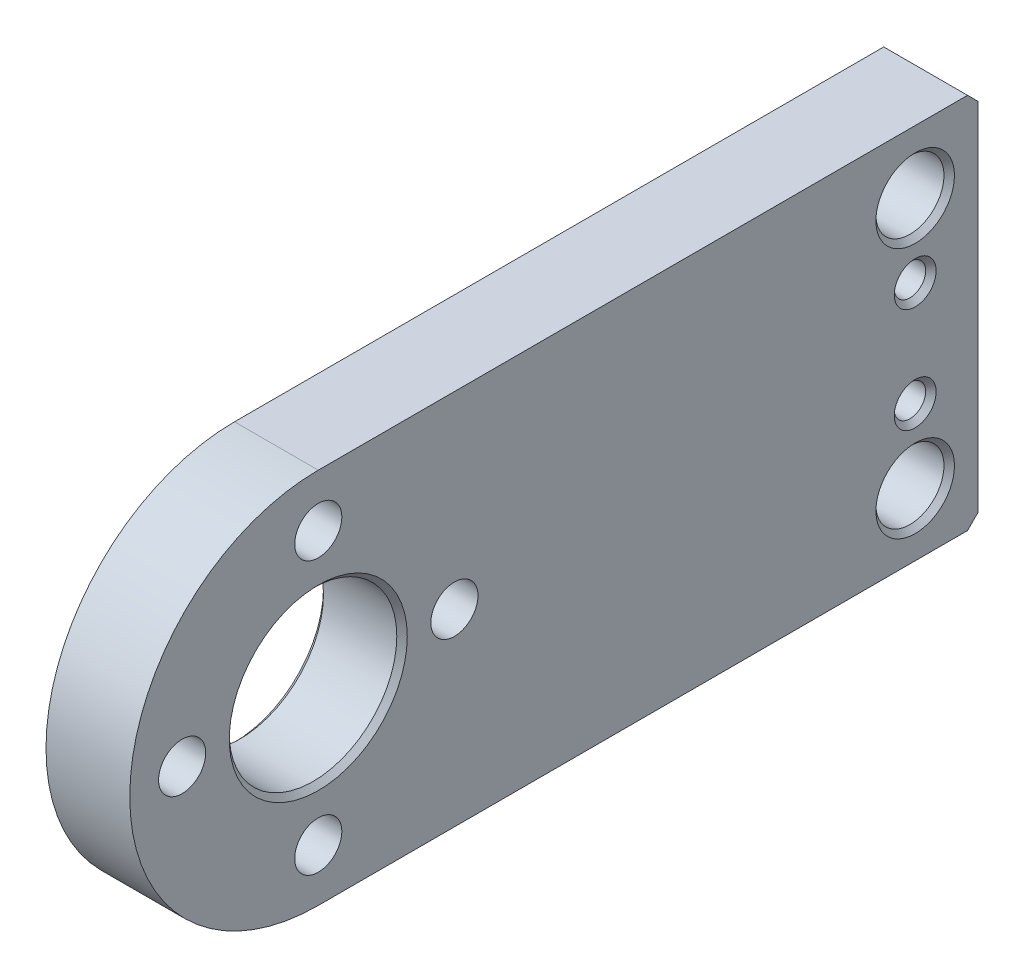
from build123d import *

# Parameters (mm, degrees)
SKETCH1_R           = 8
SKETCH1_R_2         = 2.25
SKETCH1_R_3         = 3.25
SKETCH1_R_4         = 1.5
BOSS_EXTRUDE1_DEPTH = 8
CHAMFER1_SIZE       = 1
CHAMFER2_SIZE       = 0.5


with BuildPart() as part:
    # Sketch1 → Boss-Extrude1 (new body)
    with BuildSketch(Plane(origin=(0, 0, 0), x_dir=(0, 0, -1), z_dir=(1, 0, 0))):
        with BuildLine():
            Line((-31.438596491, 20.385964912), (31.561403509, 20.385964912))
            Line((31.561403509, 20.385964912), (31.561403509, -15.614035088))
            Line((31.561403509, -15.614035088), (-31.438596491, -15.614035088))
            ThreePointArc((-31.438596491, -15.614035088), (-49.438596491, 2.385964912), (-31.438596491, 20.385964912))
        make_face()
        with Locations((-31.438596491, 2.385964912)):
            Circle(SKETCH1_R, mode=Mode.SUBTRACT)
        with Locations((-31.438596491, 15.385964912)):
            Circle(SKETCH1_R_2, mode=Mode.SUBTRACT)
        with Locations((-18.438596491, 2.385964912)):
            Circle(SKETCH1_R_2, mode=Mode.SUBTRACT)
        with Locations((-31.438596491, -10.614035088)):
            Circle(SKETCH1_R_2, mode=Mode.SUBTRACT)
        with Locations((-44.438596491, 2.385964912)):
            Circle(SKETCH1_R_2, mode=Mode.SUBTRACT)
        with Locations((25.561403509, 14.385964912)):
            Circle(SKETCH1_R_3, mode=Mode.SUBTRACT)
        with Locations((25.561403509, 7.385964912)):
            Circle(SKETCH1_R_4, mode=Mode.SUBTRACT)
        with Locations(Location((25.561403509, -2.614035088, 0), (0, 0, 180))):
            Circle(SKETCH1_R_4, mode=Mode.SUBTRACT)
        with Locations(Location((25.561403509, -9.614035088, 0), (0, 0, 180))):
            Circle(SKETCH1_R_3, mode=Mode.SUBTRACT)
    extrude(amount=BOSS_EXTRUDE1_DEPTH)

    # Chamfer1
    chamfer1_edges = [part.edges().sort_by_distance(p)[0] for p in [
        (4, 20.385964912, -31.561403509),
        (4, -15.614035088, -31.561403509),
    ]]
    chamfer(chamfer1_edges, length=CHAMFER1_SIZE)

    # Chamfer2
    chamfer2_edges = [part.edges().sort_by_distance(p)[0] for p in [
        (0, 2.385964912, 39.438596491),
        (8, 2.385964912, 39.438596491),
        (0, 14.385964912, -22.311403509),
        (8, 14.385964912, -22.311403509),
        (0, 7.385964912, -24.061403509),
        (8, 7.385964912, -24.061403509),
        (0, -2.614035088, -27.061403509),
        (8, -2.614035088, -27.061403509),
        (0, -9.614035088, -28.811403509),
        (8, -9.614035088, -28.811403509),
    ]]
    chamfer(chamfer2_edges, length=CHAMFER2_SIZE)


solid = part.part
